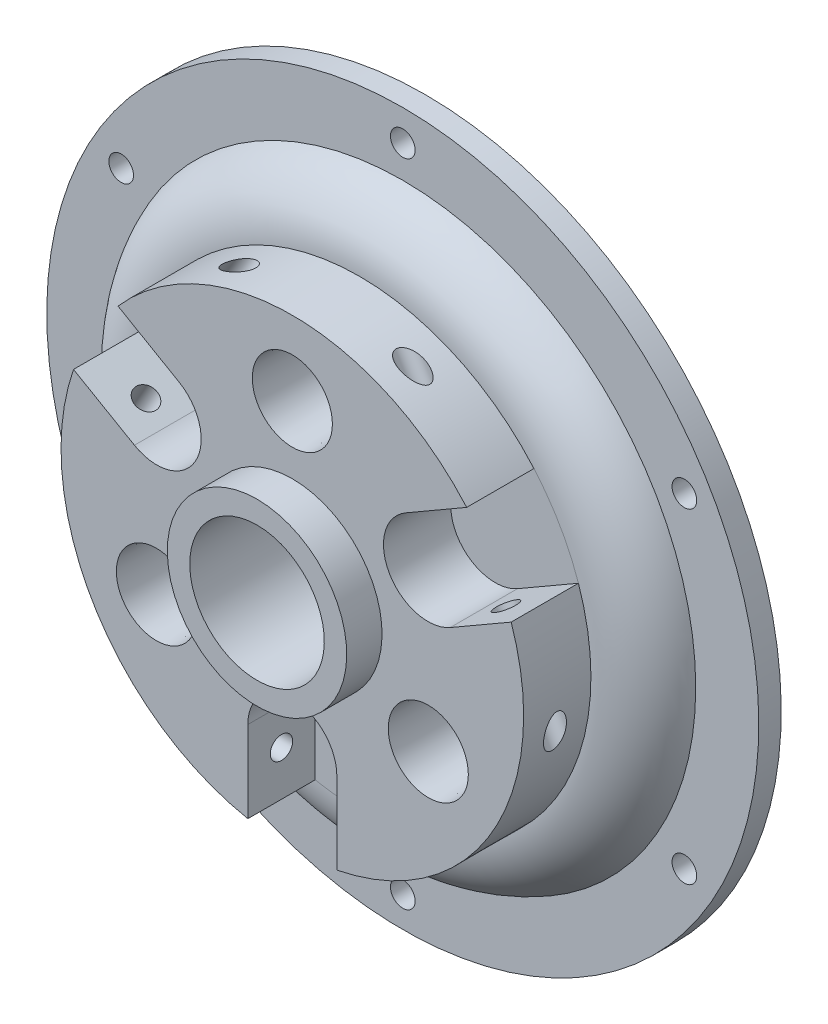
from build123d import *

# Parameters (mm, degrees)
F_1_16_NPT_TAPPED_HOLE1_AT_2_COUNT = 2
F_1_16_NPT_TAPPED_HOLE1_AT_2_PITCH = 24.248711306
F_1_16_NPT_TAPPED_HOLE1_AT_3_COUNT = 2
F_1_16_NPT_TAPPED_HOLE1_AT_3_PITCH = 24.248711306
THRUST_MOUNT_DEPTH                 = 6
SKETCH6_R                          = 1
LOCKING_PIN_DEPTH                  = 48.340521755
CIRPATTERN1_COUNT                  = 3
SKETCH7_W                          = 0.5
SKETCH7_H                          = 1
F_2_2_2_2_DIAMETER_HOLE1_D         = 2.2
CIRPATTERN2_COUNT                  = 6


with BuildPart() as part:
    # Sketch1 → Main Base (revolve)
    with BuildSketch(Plane(origin=(0, 0, 0), x_dir=(0, 0, -1), z_dir=(1, 0, 0))):
        with BuildLine():
            Line((0, 31.75), (0, 24.479181))
            ThreePointArc((0, 24.479181), (-2.722361108, 23.351542108), (-3.85, 20.629181))
            Line((-3.85, 20.629181), (-3.85, 8))
            Line((-3.85, 8), (-5.004700538, 6))
            Line((-5.004700538, 6), (-15, 6))
            Line((-15, 6), (-15, 8))
            Line((-15, 8), (-11.85, 8))
            Line((-11.85, 8), (-11.85, 20.629181))
            Line((-11.85, 20.629181), (-5.85, 20.629181))
            ThreePointArc((-5.85, 20.629181), (-4.791789853, 23.984959598), (-2, 26.126680432))
            Line((-2, 26.126680432), (-2, 31.75))
            Line((-2, 31.75), (0, 31.75))
        make_face()
    revolve(axis=Axis((0, 0, -128.05411072), (0, 0, 1)))

    # Sketch4 → 1/16 NPT Tapped Hole1 (revolve, cut)
    with BuildSketch(Plane(origin=(0, 14, 11.85), x_dir=(0, -1, 0), z_dir=(1, 0, 0))):
        Polygon((0, 0), (0, 8), (3.0734, 8), (3.0734, 6.89), (3.364817173, 6.89), (3.571113, 0), align=None)
    f_1_16_npt_tapped_hole1 = revolve(axis=Axis((0, 14, 18.2), (0, 0, -1)), mode=Mode.SUBTRACT)

    # 1/16 NPT Tapped Hole1 at 2: 1/16 NPT Tapped Hole1 ×2
    with Locations(*[Vector(0.5000000000000264, -0.8660254037844235, 0) * (i * F_1_16_NPT_TAPPED_HOLE1_AT_2_PITCH) for i in range(1, F_1_16_NPT_TAPPED_HOLE1_AT_2_COUNT)]):
        add(f_1_16_npt_tapped_hole1, mode=Mode.SUBTRACT)

    # 1/16 NPT Tapped Hole1 at 3: 1/16 NPT Tapped Hole1 ×2
    with Locations(*[Vector(-0.4999999999999739, -0.8660254037844536, 0) * (i * F_1_16_NPT_TAPPED_HOLE1_AT_3_PITCH) for i in range(1, F_1_16_NPT_TAPPED_HOLE1_AT_3_COUNT)]):
        add(f_1_16_npt_tapped_hole1, mode=Mode.SUBTRACT)

    # Sketch5 → Thrust Mount (cut)
    with BuildSketch(Plane.XY.offset(11.85)):
        with BuildLine():
            Line((25.617872251, 10.207767679), (14.081667359, 3.547336679))
            ThreePointArc((14.081667359, 3.547336679), (8.660254038, 5), (10.112917359, 10.421413321))
            Line((10.112917359, 10.421413321), (21.649122251, 17.081844321))
            ThreePointArc((21.649122251, 17.081844321), (27.070535573, 15.629181), (25.617872251, 10.207767679))
        make_face()
        with BuildLine():
            Line((-3.96875, -28.289612), (-3.96875, -12.96875))
            ThreePointArc((-3.96875, -12.96875), (0, -9), (3.96875, -12.96875))
            Line((3.96875, -12.96875), (3.96875, -28.289612))
            ThreePointArc((3.96875, -28.289612), (0, -32.258362), (-3.96875, -28.289612))
        make_face()
        with BuildLine():
            Line((-21.649122251, 17.081844321), (-10.112917359, 10.421413321))
            ThreePointArc((-10.112917359, 10.421413321), (-8.660254038, 5), (-14.081667359, 3.547336679))
            Line((-14.081667359, 3.547336679), (-25.617872251, 10.207767679))
            ThreePointArc((-25.617872251, 10.207767679), (-27.070535573, 15.629181), (-21.649122251, 17.081844321))
        make_face()
    extrude(amount=-THRUST_MOUNT_DEPTH, mode=Mode.SUBTRACT)

    # Sketch6 → Locking Pin (cut, symmetric)
    with BuildSketch(Plane(origin=(0, 0, 0), x_dir=(0, 0, -1), z_dir=(1, 0, 0))):
        with Locations((-8.85, -16.243817134)):
            Circle(SKETCH6_R)
    locking_pin = extrude(amount=LOCKING_PIN_DEPTH, both=True, mode=Mode.SUBTRACT)

    # CirPattern1: Locking Pin ×3 about axis
    cirpattern1_axis = Axis((0, 0, 55), (0, 0, -1))
    for i in range(1, CIRPATTERN1_COUNT):
        add(locking_pin.rotate(cirpattern1_axis, i * 360 / CIRPATTERN1_COUNT), mode=Mode.SUBTRACT)

    # Sketch7 → Face O-ring (revolve, cut)
    with BuildSketch(Plane(origin=(0, 0, 0), x_dir=(0, 0, -1), z_dir=(1, 0, 0)), mode=Mode.PRIVATE) as face_o_ring_sk:
        with Locations((-0.25, 26.479181)):
            Rectangle(SKETCH7_W, SKETCH7_H)
    revolve(face_o_ring_sk.sketch.rotate(Axis((0, 0, 55), (0, 0, -1)), 90), axis=Axis((0, 0, 55), (0, 0, -1)), mode=Mode.SUBTRACT)

    # Ø2.2 (2.2) Diameter Hole1 (through all)
    with Locations(Plane.XY.offset(2)):
        with Locations((0, 29)):
            f_2_2_2_2_diameter_hole1 = Hole(F_2_2_2_2_DIAMETER_HOLE1_D / 2)

    # CirPattern2: Ø2.2 (2.2) Diameter Hole1 ×6 about axis
    cirpattern2_axis = Axis((0, 0, 0), (0, 0, 1))
    for i in range(1, CIRPATTERN2_COUNT):
        add(f_2_2_2_2_diameter_hole1.rotate(cirpattern2_axis, i * 360 / CIRPATTERN2_COUNT), mode=Mode.SUBTRACT)


solid = part.part
